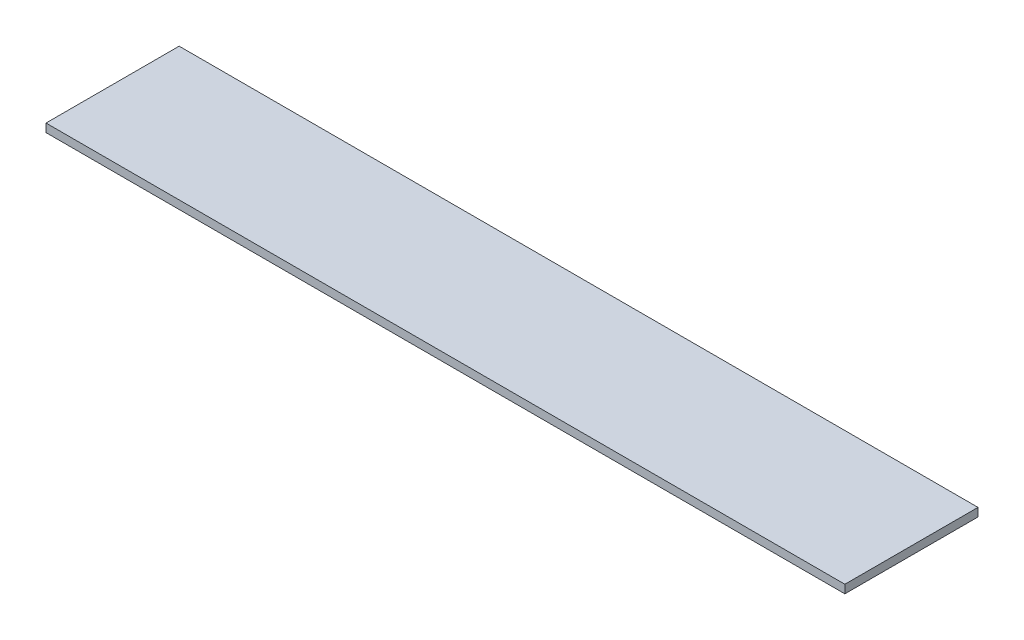
from build123d import *

# Parameters (mm, degrees)
SKETCH1_W             = 96
SKETCH1_H             = 16
BOSS_EXTRUDE1_DEPTH   = 1
BODY_MOVE_COPY1_ANGLE = 90


with BuildPart() as part:
    # Sketch1 → Boss-Extrude1 (new body)
    with BuildSketch(Plane.XY):
        with Locations((19.688888889, 8.105555556)):
            Rectangle(SKETCH1_W, SKETCH1_H)
    extrude(amount=BOSS_EXTRUDE1_DEPTH)


with BuildPart() as part_1:
    # Body-Move/Copy1: moved
    add(part.part.rotate(Axis((0, 8.105555556, 0.25), (1, 0, 0)), BODY_MOVE_COPY1_ANGLE))


solid = part_1.part
